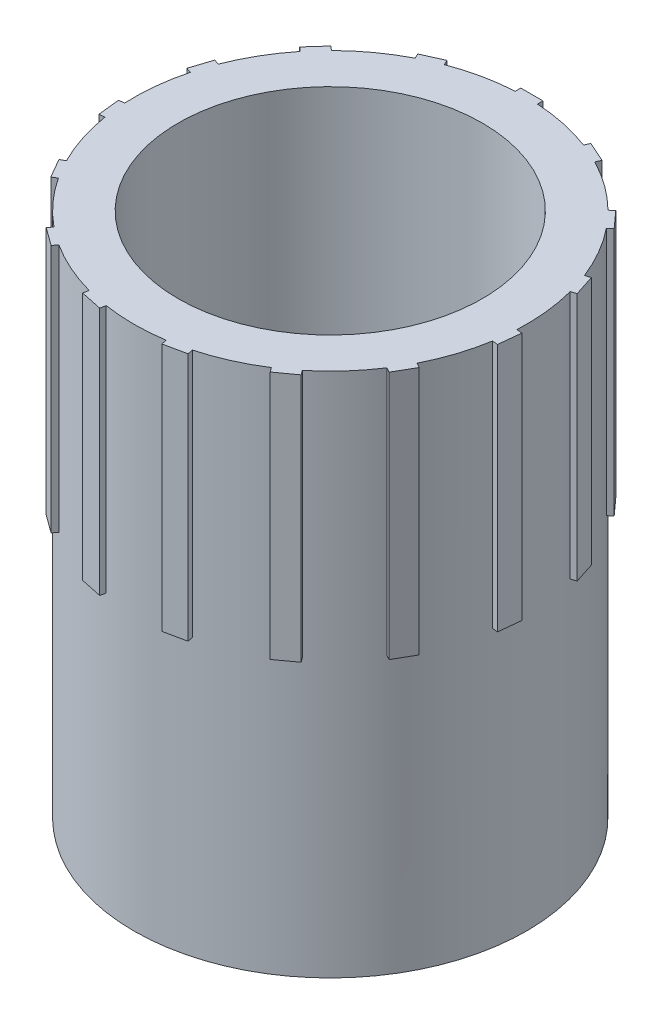
from build123d import *

# Parameters (mm, degrees)
SKETCH1_R            = 3.55
BODY_DEPTH           = 9.5
TEETH_START          = -4.5
TEETH_DEPTH          = 4.5
CIRPATTERN1_COUNT    = 15
M5_CLEARANCE_HOLE1_D = 5.5


with BuildPart() as part:
    # Sketch1 → Body (new body)
    with BuildSketch(Plane(origin=(0, 0, 0), x_dir=(1, 0, 0), z_dir=(0, 1, 0))):
        with Locations(Location((0, 0, 0), (0, 0, 270))):
            Circle(SKETCH1_R)
    extrude(amount=BODY_DEPTH)

    # Sketch2 → Teeth (add)
    with BuildSketch(Plane(origin=(0, 9.5, 0), x_dir=(1, 0, 0), z_dir=(0, 1, 0)).offset(TEETH_START)):
        with BuildLine():
            Line((-0.2, 3.54436172), (-0.2, 3.64436172))
            Line((-0.2, 3.64436172), (0.2, 3.64436172))
            Line((0.2, 3.64436172), (0.2, 3.54436172))
            ThreePointArc((0.2, 3.54436172), (0, 3.55), (-0.2, 3.54436172))
        make_face()
    teeth = extrude(amount=TEETH_DEPTH)

    # CirPattern1: Teeth ×15 about axis
    cirpattern1_axis = Axis((0, 0, 0), (0, 1, 0))
    for i in range(1, CIRPATTERN1_COUNT):
        add(teeth.rotate(cirpattern1_axis, i * 360 / CIRPATTERN1_COUNT))

    # M5 Clearance Hole1 (through all)
    with Locations(Plane(origin=(0, 9.5, 0), x_dir=(1, 0, 0), z_dir=(0, 1, 0))):
        with Locations((0, 0)):
            Hole(M5_CLEARANCE_HOLE1_D / 2)


solid = part.part
